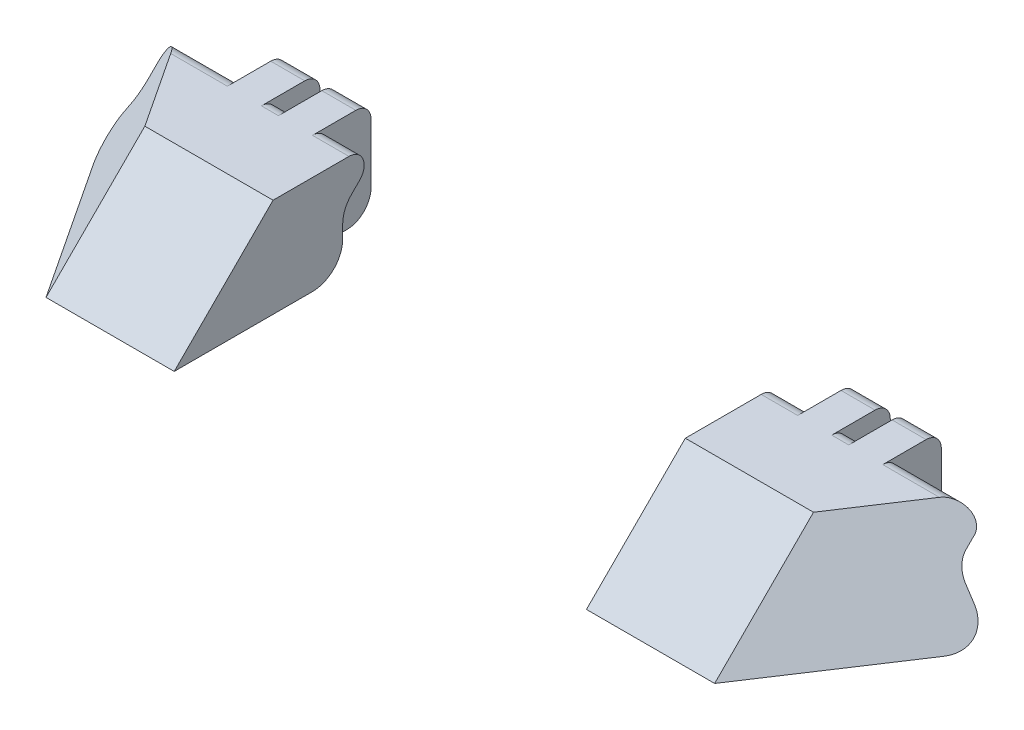
from build123d import *

# Parameters (mm, degrees)
SKETCH1_R           = 3.175
BOSS_EXTRUDE1_DEPTH = 50.8
SKETCH3_W           = 47.755928299
SKETCH3_H           = 45.242977947
CUT_EXTRUDE1_DEPTH  = 187.213946056
CUT_EXTRUDE2_START  = -7.112
CUT_EXTRUDE2_DEPTH  = 3.556
CUT_EXTRUDE3_START  = -17.78
CUT_EXTRUDE3_DEPTH  = 211.159843601
BOSS_EXTRUDE2_START = 7.62
BOSS_EXTRUDE2_DEPTH = 7.62


with BuildPart() as part:
    # Sketch1 → Boss-Extrude1 (new body)
    with BuildSketch(Plane.ZY.offset(50.684999952)):
        with BuildLine():
            Line((221.341334172, -23.01875), (200.686745093, -2.364160922))
            Line((200.686745093, -2.364160922), (175.773969826, -2.364160922))
            ThreePointArc((175.773969826, -2.364160922), (173.528905796, -3.294096891), (172.598969826, -5.539160922))
            Line((172.598969826, -5.539160922), (172.598969826, -17.93875))
            ThreePointArc((172.598969826, -17.93875), (174.086867378, -21.530852448), (177.678969826, -23.01875))
            Line((177.678969826, -23.01875), (221.341334172, -23.01875))
        make_face()
        with Locations((179.790221791, -13.97)):
            Circle(SKETCH1_R, mode=Mode.SUBTRACT)
    extrude(amount=BOSS_EXTRUDE1_DEPTH)

    # Sketch3 → Cut-Extrude1 (cut, through all)
    with BuildSketch(Plane(origin=(-107.308063907, 70.757621847, 70.757621847), x_dir=(0, 0.7071067811865436, -0.7071067811865516), z_dir=(-0.7313537016191718, 0.4822456651582992, 0.4822456651582937))):
        with Locations((-148.910708419, -32.302490469)):
            Rectangle(SKETCH3_W, SKETCH3_H)
    extrude(amount=CUT_EXTRUDE1_DEPTH, mode=Mode.SUBTRACT)

    # Sketch4 → Cut-Extrude2 (cut)
    with BuildSketch(Plane(origin=(-50.684999952, 0, 0), x_dir=(0, 0, -1), z_dir=(1, 0, 0)).offset(CUT_EXTRUDE2_START)):
        with BuildLine():
            Line((-184.280349852, -9.479871939), (-182.584702864, -7.784224952))
            ThreePointArc((-182.584702864, -7.784224952), (-181.896449379, -4.324141024), (-184.829766894, -2.364160922))
            Line((-184.829766894, -2.364160922), (-172.598969826, -2.364160922))
            Line((-172.598969826, -2.364160922), (-172.598969826, -23.01875))
            Line((-172.598969826, -23.01875), (-192.490221791, -23.01875))
            ThreePointArc((-192.490221791, -23.01875), (-188.000093731, -21.158878061), (-186.140221791, -16.66875))
            Line((-186.140221791, -16.66875), (-186.140221791, -13.97))
            ThreePointArc((-186.140221791, -13.97), (-185.656856823, -11.539960204), (-184.280349852, -9.479871939))
        make_face()
    extrude(amount=-CUT_EXTRUDE2_DEPTH, mode=Mode.SUBTRACT)

    # Sketch4<2> → Cut-Extrude3 (cut, through all)
    with BuildSketch(Plane(origin=(-50.684999952, 0, 0), x_dir=(0, 0, -1), z_dir=(1, 0, 0)).offset(CUT_EXTRUDE3_START)):
        with BuildLine():
            Line((-184.280349852, -9.479871939), (-182.584702864, -7.784224952))
            ThreePointArc((-182.584702864, -7.784224952), (-181.896449379, -4.324141024), (-184.829766894, -2.364160922))
            Line((-184.829766894, -2.364160922), (-172.598969826, -2.364160922))
            Line((-172.598969826, -2.364160922), (-172.598969826, -23.01875))
            Line((-172.598969826, -23.01875), (-192.490221791, -23.01875))
            ThreePointArc((-192.490221791, -23.01875), (-188.000093731, -21.158878061), (-186.140221791, -16.66875))
            Line((-186.140221791, -16.66875), (-186.140221791, -13.97))
            ThreePointArc((-186.140221791, -13.97), (-185.656856823, -11.539960204), (-184.280349852, -9.479871939))
        make_face()
    extrude(amount=-CUT_EXTRUDE3_DEPTH, mode=Mode.SUBTRACT)

    # Sketch5 → Boss-Extrude2 (add)
    with BuildSketch(Plane(origin=(-50.684999952, 0, 0), x_dir=(0, 0, -1), z_dir=(1, 0, 0)).offset(BOSS_EXTRUDE2_START)):
        with BuildLine():
            Line((-182.584702864, -7.784224952), (-184.280349852, -9.479871939))
            ThreePointArc((-184.280349852, -9.479871939), (-185.656856823, -11.539960204), (-186.140221791, -13.97))
            Line((-186.140221791, -13.97), (-186.140221791, -16.66875))
            ThreePointArc((-186.140221791, -16.66875), (-188.000093731, -21.158878061), (-192.490221791, -23.01875))
            Line((-192.490221791, -23.01875), (-221.341334172, -23.01875))
            Line((-221.341334172, -23.01875), (-200.686745093, -2.364160922))
            Line((-200.686745093, -2.364160922), (-184.829766894, -2.364160922))
            ThreePointArc((-184.829766894, -2.364160922), (-181.896449379, -4.324141024), (-182.584702864, -7.784224952))
        make_face()
    extrude(amount=-BOSS_EXTRUDE2_DEPTH)


with BuildPart() as body_2:
    # Mirror2: mirrored copy
    add(part.part.mirror(Plane(origin=(0, 0, 0), x_dir=(0, 0, 1), z_dir=(1, 0, 0))))


solid = Compound([part.part, body_2.part])
